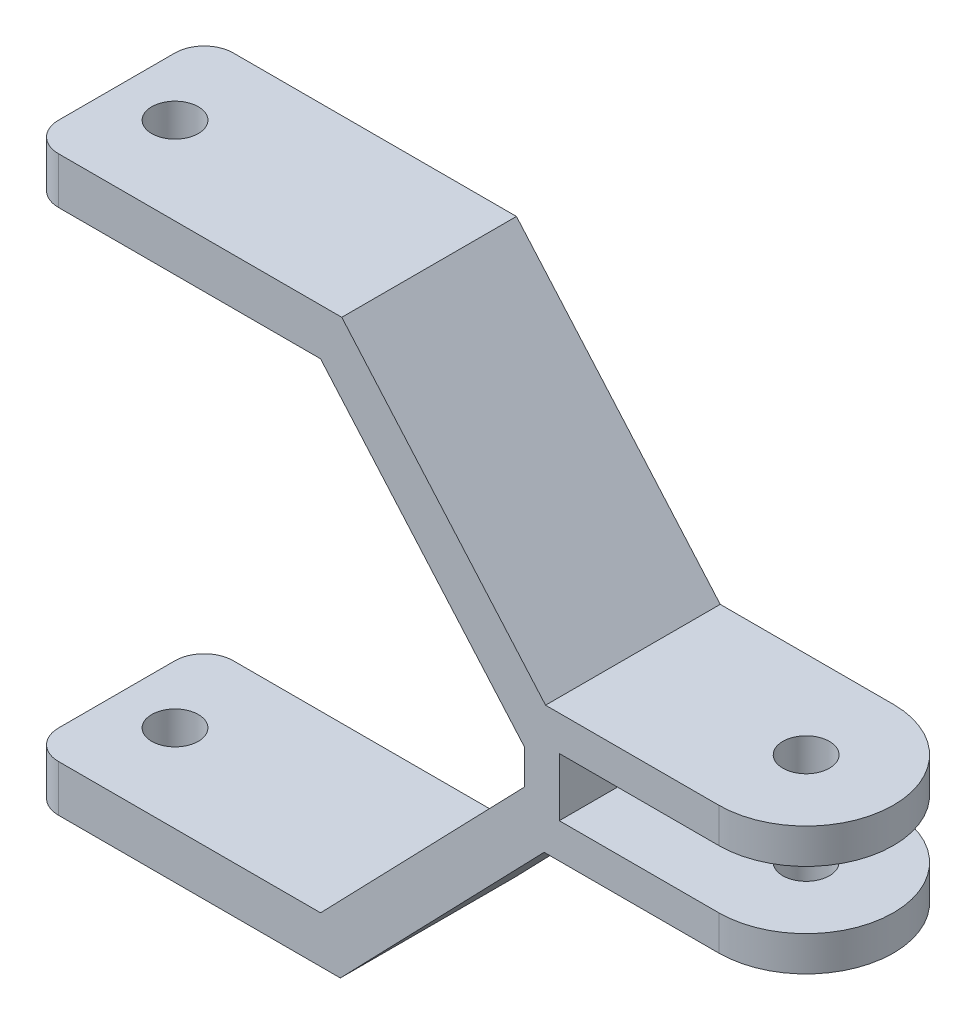
from build123d import *

# Parameters (mm, degrees)
EXTRUDE_1_DEPTH     = 15
CUT_EXTRUDE_1_REACH = 74.926
SKETCH_2_R          = 2
SKETCH_3_R          = 7.5
EXTRUDE_2_DEPTH     = 3
EXTRUDE_START       = -3
SKETCH_4_R          = 7.5
EXTRUDE_3_DEPTH     = 3
SKETCH_5_R          = 2
CUT_EXTRUDE_2_DEPTH = 11
FILLET_1_R          = 2.5


with BuildPart() as part:
    # 草圖1 → 填料-伸長1 (new body)
    with BuildSketch(Plane.XY):
        Polygon((-26.696480976, 45.2), (-47.696480976, 45.2), (-51.696480976, 45.2), (-51.696480976, 49.2), (-24.875445442, 49.2), (-7.375445442, 29.1), (7.5, 29.1), (7.5, 26.1), (-6.196480976, 26.1), (-6.196480976, 21.1), (7.5, 21.1), (7.5, 18.1), (-7.5, 18.1), (-25, 0), (-51.696480976, 0), (-51.696480976, 4), (-47.696480976, 4), (-26.696480976, 4), (-9.196480976, 22.1), (-9.196480976, 25.1), align=None)
    extrude(amount=EXTRUDE_1_DEPTH)

    # 除料-伸長1: up to this face of the body (flat: up to its plane)
    cut_extrude_1_end = Plane(part.part.faces().sort_by_distance((-38.285963209, 49.2, 7.5))[0])
    # 草圖2 → 除料-伸長1 (cut, up to the picked face)
    with BuildSketch(Plane.XZ, mode=Mode.PRIVATE) as cut_extrude_1_sk1:
        with Locations((-46.696480976, 7.5)):
            Circle(SKETCH_2_R)
    cut_extrude_1_tool1 = split(extrude(cut_extrude_1_sk1.sketch, amount=-CUT_EXTRUDE_1_REACH, mode=Mode.PRIVATE), bisect_by=cut_extrude_1_end, keep=Keep.BOTH, mode=Mode.PRIVATE)
    add(cut_extrude_1_tool1.solids().sort_by(Axis((-46.696481, 0, 7.5), (0, 1, 0)))[0], mode=Mode.SUBTRACT)

    # 草圖3 → 填料-伸長2 (add)
    with BuildSketch(Plane.XZ.offset(-18.1)):
        with Locations((7.5, 7.5)):
            Circle(SKETCH_3_R)
    extrude(amount=-EXTRUDE_2_DEPTH)

    # 草圖4 → 填料-伸長3 (add)
    with BuildSketch(Plane(origin=(0, 29.1, 0), x_dir=(1, 0, 0), z_dir=(0, 1, 0)).offset(EXTRUDE_START)):
        with Locations((7.5, -7.5)):
            Circle(SKETCH_4_R)
    extrude(amount=EXTRUDE_3_DEPTH)

    # 草圖5 → 除料-伸長2 (cut)
    with BuildSketch(Plane(origin=(0, 29.1, 0), x_dir=(1, 0, 0), z_dir=(0, 1, 0))):
        with Locations(Location((7.5, -7.5, 0), (0, 0, 270))):
            Circle(SKETCH_5_R)
    extrude(amount=-CUT_EXTRUDE_2_DEPTH, mode=Mode.SUBTRACT)

    # 圓角1
    fillet_1_edges = [part.edges().sort_by_distance(p)[0] for p in [
        (-51.696480976, 47.2, 0),
        (-51.696480976, 2, 15),
        (-51.696480976, 2, 0),
        (-51.696480976, 47.2, 15),
    ]]
    fillet(fillet_1_edges, radius=FILLET_1_R)


solid = part.part
